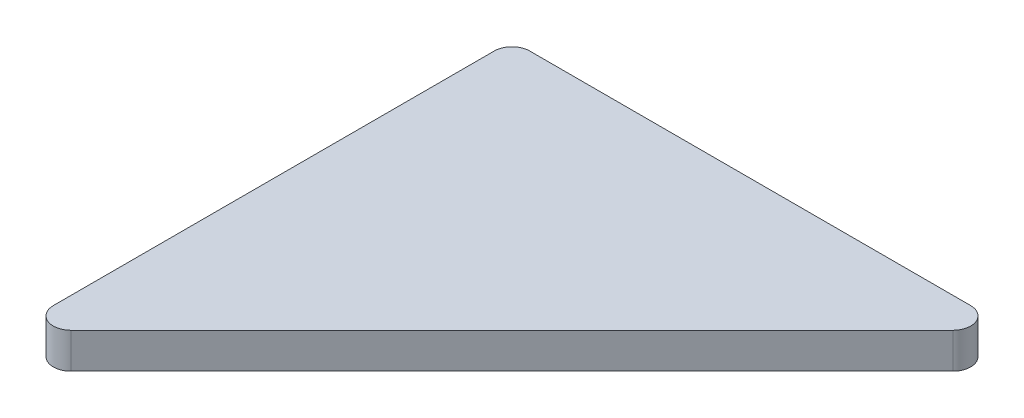
from build123d import *

# Parameters (mm, degrees)
BOSS_EXTRUDE1_DEPTH = 10


with BuildPart() as part:
    # Sketch1 → Boss-Extrude1 (new body)
    with BuildSketch(Plane(origin=(0, 0, 0), x_dir=(1, 0, 0), z_dir=(0, 1, 0))):
        with BuildLine():
            Line((8.535533906, -132.885822331), (132.885822331, -8.535533906))
            ThreePointArc((132.885822331, -8.535533906), (133.969686088, -3.086582838), (129.350288425, 0))
            Line((129.350288425, 0), (5, 0))
            ThreePointArc((5, 0), (1.464466094, -1.464466094), (0, -5))
            Line((0, -5), (0, -129.350288425))
            ThreePointArc((0, -129.350288425), (3.086582838, -133.969686088), (8.535533906, -132.885822331))
        make_face()
    extrude(amount=-BOSS_EXTRUDE1_DEPTH)


solid = part.part
